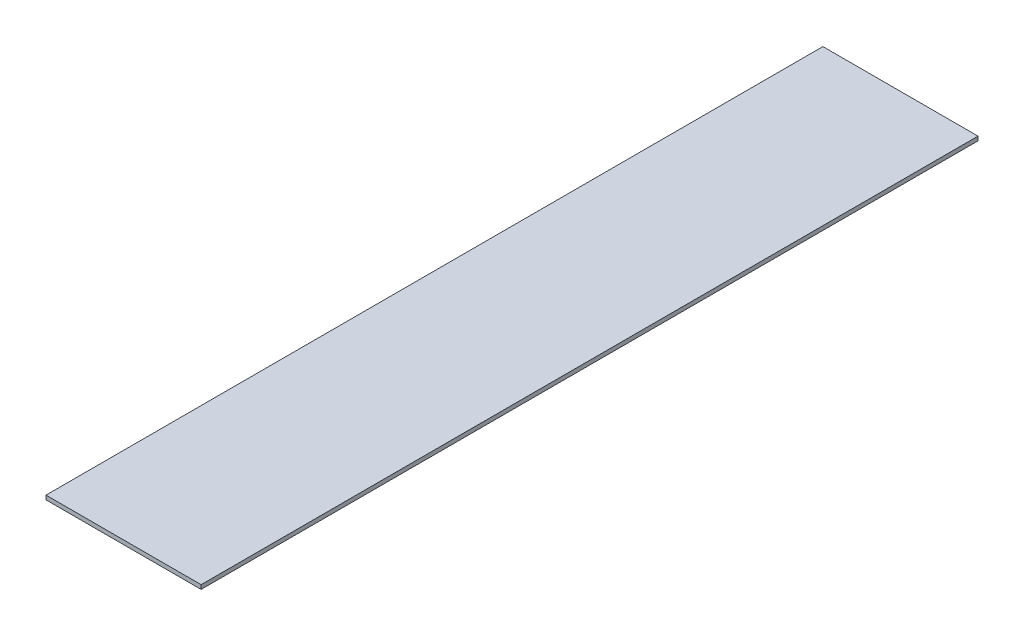
from build123d import *

# Parameters (mm, degrees)
SKETCH1_W           = 113
SKETCH1_H           = 566
BOSS_EXTRUDE1_DEPTH = 3


with BuildPart() as part:
    # Sketch1 → Boss-Extrude1 (new body)
    with BuildSketch(Plane(origin=(0, 0, 0), x_dir=(1, 0, 0), z_dir=(0, 1, 0))):
        with Locations((56.5, 283)):
            Rectangle(SKETCH1_W, SKETCH1_H)
    extrude(amount=BOSS_EXTRUDE1_DEPTH)


solid = part.part
